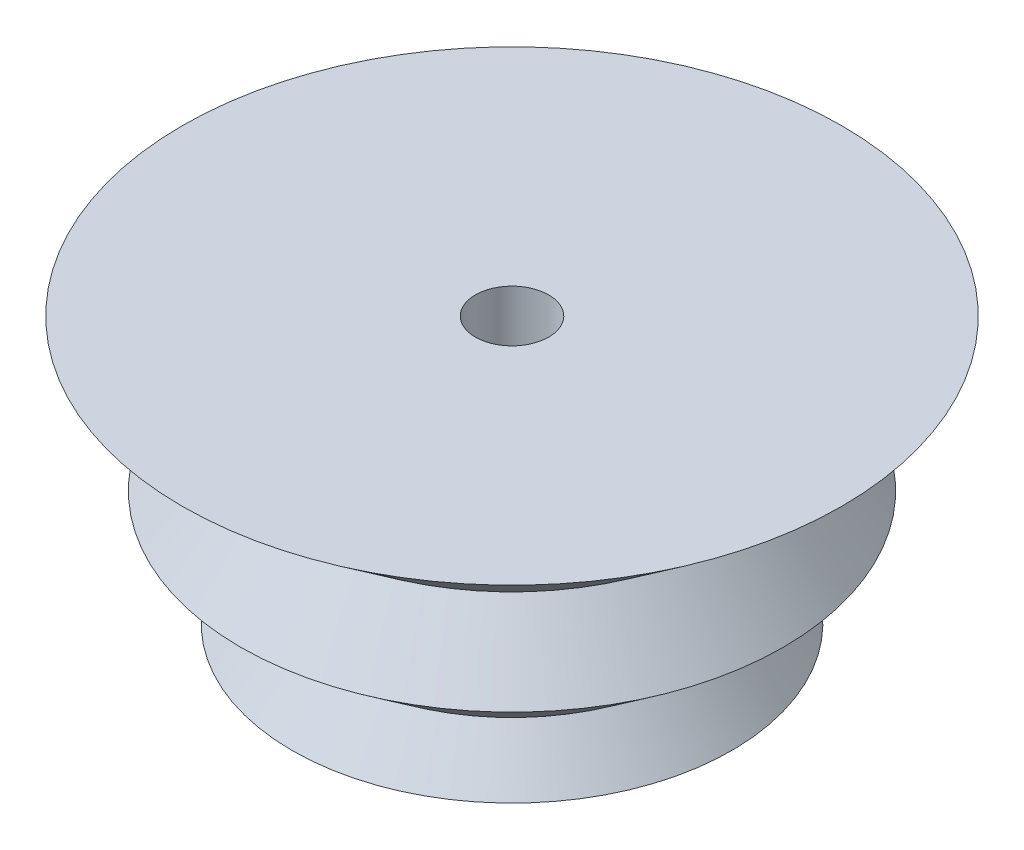
from build123d import *

# Parameters (mm, degrees)
SKETCH2_R          = 0.5
CUT_EXTRUDE1_DEPTH = 8.329743599


with BuildPart() as part:
    # Sketch1 → Revolve1 (revolve)
    with BuildSketch(Plane.XY, mode=Mode.PRIVATE) as revolve1_sk:
        Polygon((0, 0), (3, 0), (2.5, 0.657540642), (3.702619215, 1.572023442), (3, 2.496024821), (4.5, 3.636638726), (0, 3.636638726), align=None)
    revolve(revolve1_sk.sketch.rotate(Axis((0, 3.636638726, 0), (0, -1, 0)), 90), axis=Axis((0, 3.636638726, 0), (0, -1, 0)))

    # Sketch2 → Cut-Extrude1 (cut, through all)
    with BuildSketch(Plane(origin=(0, 3.636638726, 0), x_dir=(1, 0, 0), z_dir=(0, 1, 0))):
        with Locations(Location((0, 0, 0), (0, 0, 270))):
            Circle(SKETCH2_R)
    extrude(amount=-CUT_EXTRUDE1_DEPTH, mode=Mode.SUBTRACT)


solid = part.part
